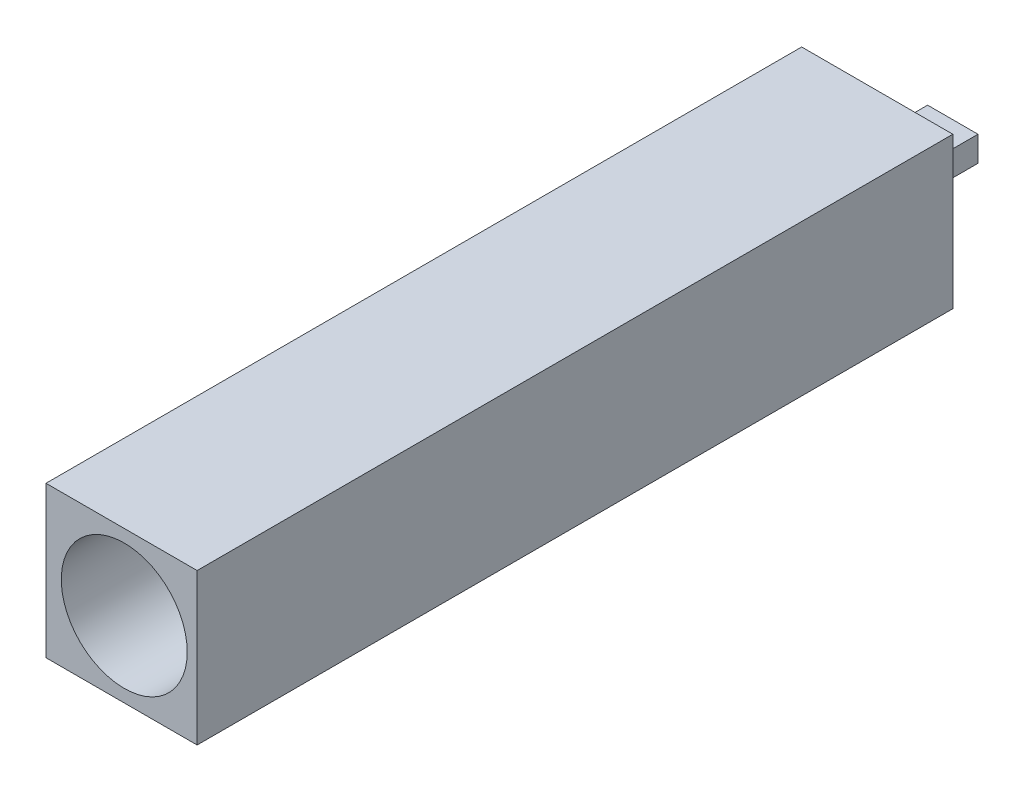
from build123d import *

# Parameters (mm, degrees)
SKETCH1_W           = 30
SKETCH1_H           = 30
BOSS_EXTRUDE1_DEPTH = 150
SKETCH2_R           = 12.5
CUT_EXTRUDE1_DEPTH  = 120
SKETCH3_W           = 10
SKETCH3_H           = 5
BOSS_EXTRUDE2_DEPTH = 15
SKETCH4_R           = 2.5
CUT_EXTRUDE2_DEPTH  = 10


with BuildPart() as part:
    # Sketch1 → Boss-Extrude1 (new body)
    with BuildSketch(Plane.XY):
        with Locations((-15, 15)):
            Rectangle(SKETCH1_W, SKETCH1_H)
    extrude(amount=BOSS_EXTRUDE1_DEPTH)

    # Sketch2 → Cut-Extrude1 (cut)
    with BuildSketch(Plane.XY.offset(150)):
        with Locations((-14.468504341, 15)):
            Circle(SKETCH2_R)
    extrude(amount=-CUT_EXTRUDE1_DEPTH, mode=Mode.SUBTRACT)

    # Sketch3 → Boss-Extrude2 (add)
    with BuildSketch(Plane(origin=(0, 0, 0), x_dir=(-1, 0, 0), z_dir=(0, 0, -1))):
        with Locations((15, 15)):
            Rectangle(SKETCH3_W, SKETCH3_H)
    extrude(amount=BOSS_EXTRUDE2_DEPTH)

    # Sketch4 → Cut-Extrude2 (cut)
    with BuildSketch(Plane.XZ.offset(-12.5)):
        with Locations((-15, -10)):
            Circle(SKETCH4_R)
    extrude(amount=-CUT_EXTRUDE2_DEPTH, mode=Mode.SUBTRACT)


solid = part.part
